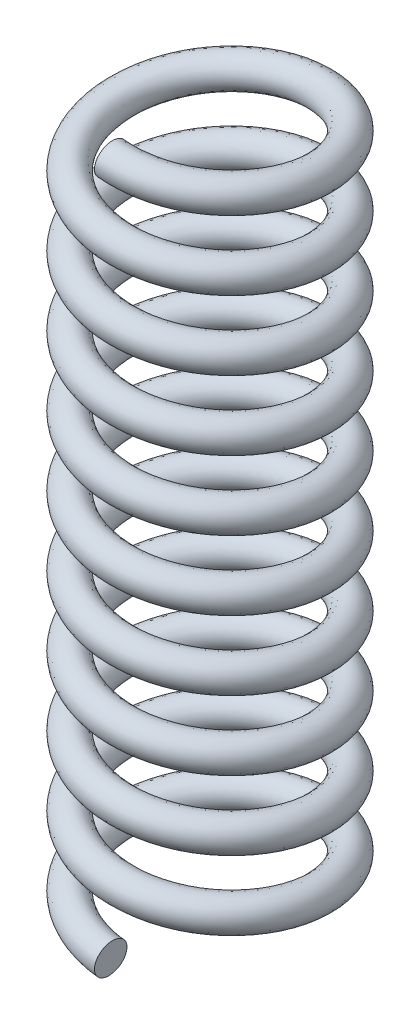
from build123d import *

# Parameters (mm, degrees)
SWEEP2_PITCH     = 1.5
SWEEP2_HEIGHT    = 15
SWEEP2_RADIUS    = 2.15
SWEEP2_PROFILE_R = 0.35


with BuildPart() as part:
    # Sweep2: sweep along a helix
    with BuildLine() as sweep2_path:
        Helix(SWEEP2_PITCH, SWEEP2_HEIGHT, SWEEP2_RADIUS, center=(0, 0, 0), direction=(0, 1, 0), lefthand=True)
    # Sweep2 profile (on start of the path) → Sweep2 (sweep)
    with BuildSketch(Plane(origin=(0, 0, 2.15), x_dir=(-0.11036007374846091, -0.9938916712208803, 0), z_dir=(-0.9938916712208803, 0.11036007374846091, -1.6096289135725962e-13))):
        Circle(SWEEP2_PROFILE_R)
    sweep(path=sweep2_path.line, is_frenet=True)


solid = part.part
